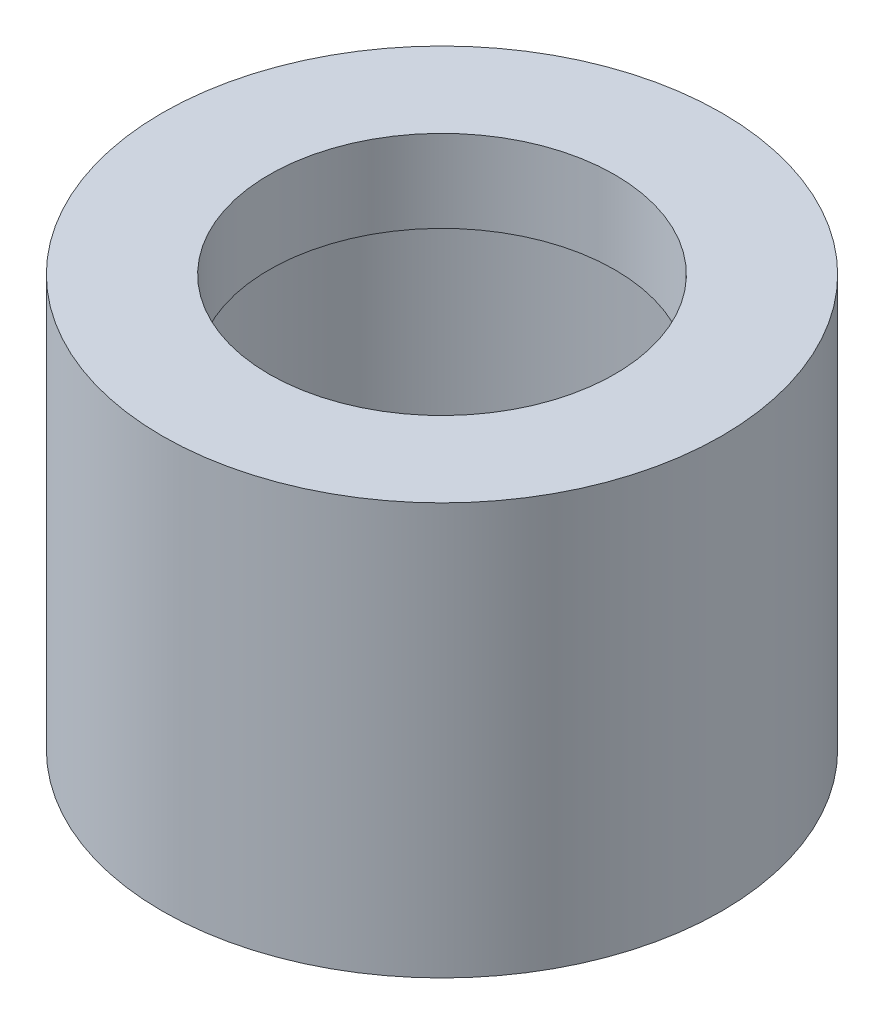
from build123d import *

# Parameters (mm, degrees)
SKETCH1_R           = 17
SKETCH1_R_2         = 15
BOSS_EXTRUDE1_DEPTH = 20
SKETCH2_R           = 17
SKETCH2_R_2         = 15
SKETCH2_R_3         = 10.5
BOSS_EXTRUDE2_DEPTH = 5


with BuildPart() as part:
    # Sketch1 → Boss-Extrude1 (new body)
    with BuildSketch(Plane(origin=(0, 0, 0), x_dir=(1, 0, 0), z_dir=(0, 1, 0))):
        with Locations(Location((0, 0, 0), (0, 0, 270))):
            Circle(SKETCH1_R)
        with Locations(Location((0, 0, 0), (0, 0, 270))):
            Circle(SKETCH1_R_2, mode=Mode.SUBTRACT)
    extrude(amount=BOSS_EXTRUDE1_DEPTH)

    # Sketch2 → Boss-Extrude2 (add)
    # profile 1 of 2: a face of its own
    with BuildSketch(Plane(origin=(0, 20, 0), x_dir=(1, 0, 0), z_dir=(0, 1, 0))):
        with Locations(Location((0, 0, 0), (0, 0, 270))):
            Circle(SKETCH2_R)
        with Locations(Location((0, 0, 0), (0, 0, 270))):
            Circle(SKETCH2_R_2, mode=Mode.SUBTRACT)
    # profile 2 of 2: a face of its own
    with BuildSketch(Plane(origin=(0, 20, 0), x_dir=(1, 0, 0), z_dir=(0, 1, 0))):
        with Locations(Location((0, 0, 0), (0, 0, 270))):
            Circle(SKETCH2_R_2)
        with Locations(Location((0, 0, 0), (0, 0, 270))):
            Circle(SKETCH2_R_3, mode=Mode.SUBTRACT)
    extrude(amount=BOSS_EXTRUDE2_DEPTH)


solid = part.part
